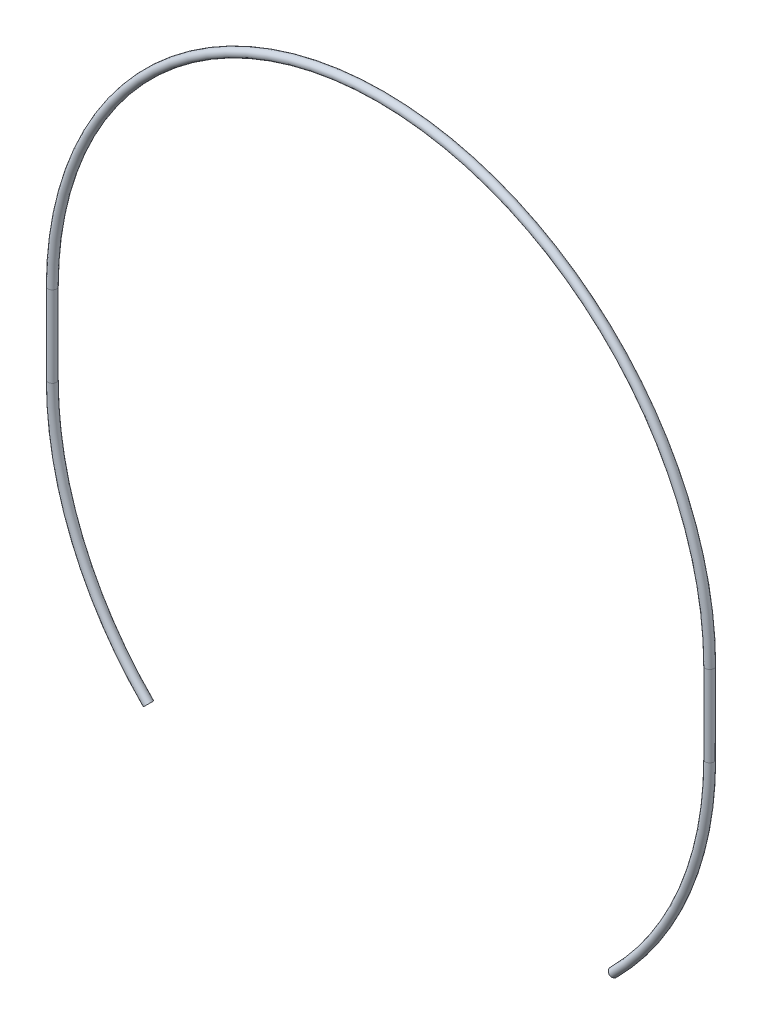
from build123d import *

# Parameters (mm, degrees)
SWEEP1_PROFILE_R = 2.5


with BuildPart() as part:
    # Sweep1: sweep along a path in Sketch10
    with BuildLine(Plane.XY) as sweep1_path:
        ThreePointArc((-137.885822331, -185.885822331), (-180.15650884, -122.623269311), (-195, -48))
        Line((-195, -48), (-195, 0))
        ThreePointArc((-195, 0), (0, 195), (195, 0))
        Line((195, 0), (195, -48))
        ThreePointArc((195, -48), (180.15650884, -122.623269311), (137.885822331, -185.885822331))
    # Sweep1 profile (on start of the path) → Sweep1 (sweep)
    with BuildSketch(Plane(origin=(-137.885822331, -185.885822331, 0), x_dir=(0.7071067811865517, 0.7071067811865435, 0), z_dir=(-0.7071067811865435, 0.7071067811865517, 0))):
        Circle(SWEEP1_PROFILE_R)
    sweep(path=sweep1_path.line)


solid = part.part
